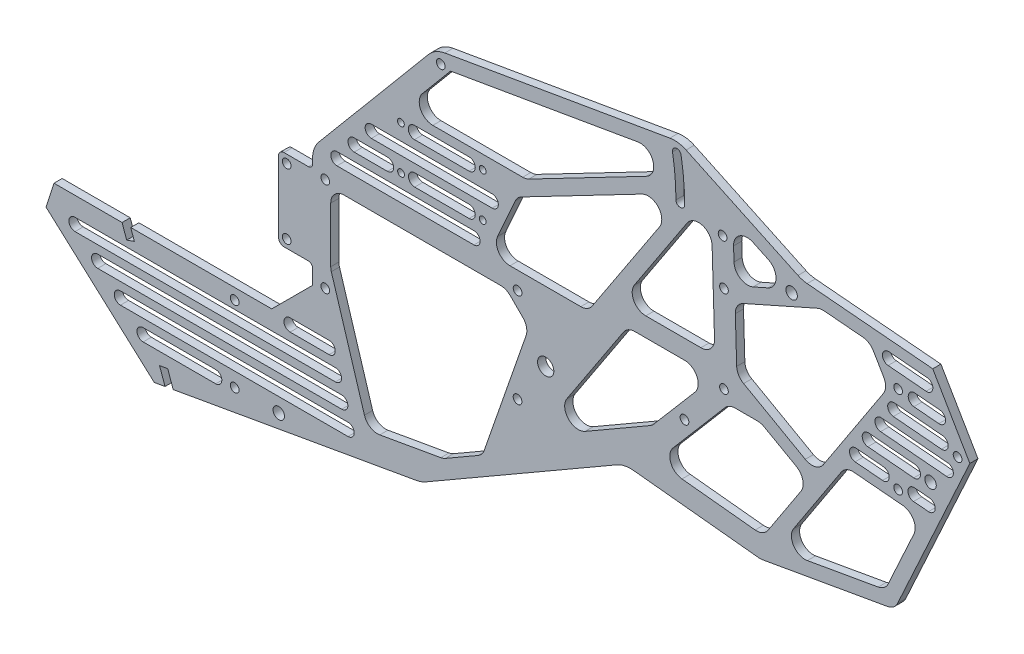
from build123d import *

# Parameters (mm, degrees)
SKETCH1_R           = 1.6
SKETCH1_R_2         = 3
SKETCH1_R_3         = 2.1
BOSS_EXTRUDE1_DEPTH = 3
CUT_EXTRUDE1_DEPTH  = 3
CUT_EXTRUDE2_DEPTH  = 3
SKETCH4_R           = 1.6
SKETCH4_R_2         = 1.25
CUT_EXTRUDE3_DEPTH  = 3
SKETCH5_R           = 1.6
SKETCH5_R_2         = 2.1
CUT_EXTRUDE4_DEPTH  = 3
CUT_EXTRUDE5_DEPTH  = 3
CUT_EXTRUDE6_DEPTH  = 3
FILLET1_R           = 5
FILLET2_R           = 5


with BuildPart() as part:
    # Sketch1 → Boss-Extrude1 (new body)
    with BuildSketch(Plane.XY):
        with BuildLine():
            Line((33.606433282, 69.354528427), (33.606433282, 67.494230769))
            ThreePointArc((33.606433282, 67.494230769), (33.167093454, 66.433570597), (32.106433282, 65.994230769))
            Line((32.106433282, 65.994230769), (23.106433282, 65.994230769))
            ThreePointArc((23.106433282, 65.994230769), (21.692219719, 65.408444332), (21.106433282, 63.994230769))
            Line((21.106433282, 63.994230769), (21.106433282, 37.994230769))
            ThreePointArc((21.106433282, 37.994230769), (21.692219719, 36.580017207), (23.106433282, 35.994230769))
            Line((23.106433282, 35.994230769), (32.106433282, 35.994230769))
            ThreePointArc((32.106433282, 35.994230769), (33.167093454, 35.554890941), (33.606433282, 34.494230769))
            Line((33.606433282, 34.494230769), (33.606433282, 28.994230769))
            Line((33.606433282, 28.994230769), (18.606433282, 13.994230769))
            Line((18.606433282, 13.994230769), (-33.208685877, 13.994230769))
            Line((-33.208685877, 13.994230769), (-31.865678416, 10.226428896))
            Line((-31.865678416, 10.226428896), (-34.691529821, 9.2191733))
            Line((-34.691529821, 9.2191733), (-36.393566718, 13.994230769))
            Line((-36.393566718, 13.994230769), (-61.393566718, 13.994230769))
            Line((-61.393566718, 13.994230769), (-64.338240595, 4.931456458))
            Line((-64.338240595, 4.931456458), (-24.540435349, -31.005769231))
            Line((-24.540435349, -31.005769231), (-20.601204337, -30.31117652))
            Line((-20.601204337, -30.31117652), (-22.615715529, -24.65947371))
            Line((-22.615715529, -24.65947371), (-19.619169292, -24.131101759))
            Line((-19.619169292, -24.131101759), (-17.604658099, -29.782804569))
            Line((-17.604658099, -29.782804569), (71.833626772, -14.012421838))
            ThreePointArc((71.833626772, -14.012421838), (73.517346428, -13.561270516), (75.097144995, -12.824598346))
            Line((75.097144995, -12.824598346), (145.414901265, 27.773377165))
            ThreePointArc((145.414901265, 27.773377165), (148.329156871, 28.893188072), (151.446707108, 29.059749526))
            Line((151.446707108, 29.059749526), (212.432702142, 22.733412992))
            ThreePointArc((212.432702142, 22.733412992), (215.302065541, 21.994439853), (217.828932512, 20.447096669))
            ThreePointArc((217.828932512, 20.447096669), (261.451176936, 21.093233821), (267.109241255, 64.351805341))
            ThreePointArc((267.109241255, 64.351805341), (265.48687235, 69.095784942), (266.370965215, 74.030944831))
            Line((266.370965215, 74.030944831), (275.117398408, 93.06941092))
            Line((275.117398408, 93.06941092), (261.484759484, 116.375014451))
            Line((261.484759484, 116.375014451), (215.3420672, 120.41197693))
            ThreePointArc((215.3420672, 120.41197693), (213.606741864, 120.719693633), (211.952387443, 121.327274937))
            Line((211.952387443, 121.327274937), (170.861805565, 140.682145004))
            ThreePointArc((170.861805565, 140.682145004), (167.944202702, 141.544817238), (164.902224852, 141.490222269))
            Line((164.902224852, 141.490222269), (82.210010789, 127.239213849))
            ThreePointArc((82.210010789, 127.239213849), (78.925127101, 126.054403786), (76.247909886, 123.812363706))
            Line((76.247909886, 123.812363706), (35.945988851, 75.782404523))
            ThreePointArc((35.945988851, 75.782404523), (34.209507074, 72.77472986), (33.606433282, 69.354528427))
        make_face()
        with Locations((5, -17.865711058)):
            Circle(SKETCH1_R, mode=Mode.SUBTRACT)
        with Locations((5, 9.994230769)):
            Circle(SKETCH1_R, mode=Mode.SUBTRACT)
        with Locations((24.106433282, 38.994230769)):
            Circle(SKETCH1_R, mode=Mode.SUBTRACT)
        with Locations((38.27641453, 30.394230769)):
            Circle(SKETCH1_R, mode=Mode.SUBTRACT)
        with Locations((24.106433282, 62.994230769)):
            Circle(SKETCH1_R, mode=Mode.SUBTRACT)
        with Locations((38.27641453, 64.994230769)):
            Circle(SKETCH1_R, mode=Mode.SUBTRACT)
        with Locations((80.724281303, 122.924200116)):
            Circle(SKETCH1_R, mode=Mode.SUBTRACT)
        with Locations((108.936452034, 30.394230769)):
            Circle(SKETCH1_R, mode=Mode.SUBTRACT)
        with Locations((119.266433282, 45.994230769)):
            Circle(SKETCH1_R_2, mode=Mode.SUBTRACT)
        with Locations((108.936452034, 64.994230769)):
            Circle(SKETCH1_R, mode=Mode.SUBTRACT)
        with Locations((21.186685258, -17.865711058)):
            Circle(SKETCH1_R_3, mode=Mode.SUBTRACT)
        with BuildLine():
            Line((-2, -20.135652886), (-28.647304351, -20.135652886))
            ThreePointArc((-28.647304351, -20.135652886), (-30.917246179, -17.865711058), (-28.647304351, -15.595769231))
            Line((-28.647304351, -15.595769231), (-2, -15.595769231))
            ThreePointArc((-2, -15.595769231), (0.269941827, -17.865711058), (-2, -20.135652886))
        make_face(mode=Mode.SUBTRACT)
        with BuildLine():
            Line((46.626657738, -12.605652886), (-36.986219439, -12.605652886))
            ThreePointArc((-36.986219439, -12.605652886), (-39.256161266, -10.335711058), (-36.986219439, -8.065769231))
            Line((-36.986219439, -8.065769231), (46.626657738, -8.065769231))
            ThreePointArc((46.626657738, -8.065769231), (48.896599565, -10.335711058), (46.626657738, -12.605652886))
        make_face(mode=Mode.SUBTRACT)
        with BuildLine():
            Line((44.309159487, -5.075652886), (-45.325134526, -5.075652886))
            ThreePointArc((-45.325134526, -5.075652886), (-47.595076354, -2.805711058), (-45.325134526, -0.535769231))
            Line((-45.325134526, -0.535769231), (44.309159487, -0.535769231))
            ThreePointArc((44.309159487, -0.535769231), (46.579101315, -2.805711058), (44.309159487, -5.075652886))
        make_face(mode=Mode.SUBTRACT)
        with BuildLine():
            Line((41.991661236, 2.454347114), (-53.664049614, 2.454347114))
            ThreePointArc((-53.664049614, 2.454347114), (-55.933991441, 4.724288942), (-53.664049614, 6.994230769))
            Line((-53.664049614, 6.994230769), (41.991661236, 6.994230769))
            ThreePointArc((41.991661236, 6.994230769), (44.261603064, 4.724288942), (41.991661236, 2.454347114))
        make_face(mode=Mode.SUBTRACT)
        with BuildLine():
            Line((39.674162986, 9.984347114), (25.351772829, 9.984347114))
            ThreePointArc((25.351772829, 9.984347114), (23.081831001, 12.254288942), (25.351772829, 14.524230769))
            Line((25.351772829, 14.524230769), (39.674162986, 14.524230769))
            ThreePointArc((39.674162986, 14.524230769), (41.944104813, 12.254288942), (39.674162986, 9.984347114))
        make_face(mode=Mode.SUBTRACT)
        with BuildLine():
            Line((112.062626277, 52.219115126), (96.660010447, 7.956769522))
            ThreePointArc((96.660010447, 7.956769522), (95.790683483, 6.413353898), (94.437758812, 5.269913478))
            Line((94.437758812, 5.269913478), (82.378204185, -1.692673633))
            ThreePointArc((82.378204185, -1.692673633), (81.588304901, -2.061009718), (80.746445073, -2.286585379))
            Line((80.746445073, -2.286585379), (58.320914344, -6.240811503))
            ThreePointArc((58.320914344, -6.240811503), (54.844152372, -5.582404902), (52.673881025, -2.787535434))
            Line((52.673881025, -2.787535434), (40.497622099, 36.775484596))
            ThreePointArc((40.497622099, 36.775484596), (40.332025682, 37.50259487), (40.27641453, 38.246247292))
            Line((40.27641453, 38.246247292), (40.27641453, 58.494230769))
            ThreePointArc((40.27641453, 58.494230769), (41.740880624, 62.029764675), (45.27641453, 63.494230769))
            Line((45.27641453, 63.494230769), (102.708529973, 63.494230769))
            ThreePointArc((102.708529973, 63.494230769), (104.621947134, 63.113628432), (106.244063878, 62.029764675))
            Line((106.244063878, 62.029764675), (110.875908547, 57.397920006))
            ThreePointArc((110.875908547, 57.397920006), (112.214055028, 54.97918487), (112.062626277, 52.219115126))
        make_face(mode=Mode.SUBTRACT)
        with BuildLine():
            ThreePointArc((167.124281303, 122.924200116), (168.724281303, 121.324200116), (170.324281303, 122.924200116))
            ThreePointArc((170.324281303, 122.924200116), (169.998274999, 130.560563753), (169.02262841, 138.141358133))
            ThreePointArc((169.02262841, 138.141358133), (167.174137247, 139.446379366), (165.869116014, 137.597888204))
            ThreePointArc((165.869116014, 137.597888204), (166.809918081, 130.28783648), (167.124281303, 122.924200116))
        make_face(mode=Mode.SUBTRACT)
    extrude(amount=BOSS_EXTRUDE1_DEPTH)

    # Sketch2 → Cut-Extrude1 (cut)
    with BuildSketch(Plane.XY.offset(3)):
        Polygon((151.446707108, 29.059749526), (241.422875717, 19.726139041), (275.117398408, 93.06941092), (318.53181197, -44.262654747), align=None)
    extrude(amount=-CUT_EXTRUDE1_DEPTH, mode=Mode.SUBTRACT)

    # Sketch3 → Cut-Extrude2 (cut)
    with BuildSketch(Plane.XY.offset(3)):
        Polygon((198.229692038, 24.206751611), (247.470079689, 32.889160494), (241.422875717, 19.726139041), align=None)
    extrude(amount=-CUT_EXTRUDE2_DEPTH, mode=Mode.SUBTRACT)

    # Sketch4 → Cut-Extrude3 (cut)
    with BuildSketch(Plane.XY.offset(3)):
        with Locations((184.767611591, 103.568989757)):
            Circle(SKETCH4_R)
        with Locations((184.767611591, 71.568989757)):
            Circle(SKETCH4_R)
        with Locations((248.767611591, 103.568989757)):
            Circle(SKETCH4_R)
        with Locations((248.767611591, 71.568989757)):
            Circle(SKETCH4_R)
        with Locations((66.057748953, 96.994230769)):
            Circle(SKETCH4_R_2)
        with Locations((96.120516229, 96.994230769)):
            Circle(SKETCH4_R_2)
        with Locations((66.120516229, 80.994230769)):
            Circle(SKETCH4_R_2)
        with Locations((96.120516229, 80.994230769)):
            Circle(SKETCH4_R_2)
    extrude(amount=-CUT_EXTRUDE3_DEPTH, mode=Mode.SUBTRACT)

    # Sketch5 → Cut-Extrude4 (cut)
    with BuildSketch(Plane.XY.offset(3)):
        with Locations((184.267611591, 120.119180009)):
            Circle(SKETCH5_R)
        with Locations((170.267611591, 54.568989757)):
            Circle(SKETCH5_R)
        with Locations((270.61335305, 92.847113196)):
            Circle(SKETCH5_R)
        with Locations((209.641360773, 114.61683213)):
            Circle(SKETCH5_R_2)
        with Locations((260.685601414, 79.876300594)):
            Circle(SKETCH5_R_2)
    extrude(amount=-CUT_EXTRUDE4_DEPTH, mode=Mode.SUBTRACT)

    # Sketch6 → Cut-Extrude5 (cut)
    with BuildSketch(Plane.XY.offset(3)):
        with BuildLine():
            Line((134.85979926, 71.494230769), (98.461835392, 71.494230769))
            Line((98.461835392, 71.494230769), (108.765182202, 94.659315822))
            Line((108.765182202, 94.659315822), (154.610313298, 118.522297762))
            ThreePointArc((154.610313298, 118.522297762), (160.630667086, 117.437151644), (161.094872175, 111.337420874))
            Line((161.094872175, 111.337420874), (134.85979926, 71.494230769))
        make_face()
        with BuildLine():
            Line((156.267621783, 125.02173291), (112.027599428, 101.994230769))
            Line((112.027599428, 101.994230769), (67.078173611, 101.994230769))
            Line((67.078173611, 101.994230769), (84.307147675, 122.526922507))
            Line((84.307147675, 122.526922507), (153.109895929, 134.384248566))
            ThreePointArc((153.109895929, 134.384248566), (158.696854523, 131.054814092), (156.267621783, 125.02173291))
        make_face()
        with BuildLine():
            Line((42.565340857, 76.034114424), (92.90473711, 76.034114424))
            ThreePointArc((92.90473711, 76.034114424), (95.174678937, 73.764172597), (92.90473711, 71.494230769))
            Line((92.90473711, 71.494230769), (42.565340857, 71.494230769))
            ThreePointArc((42.565340857, 71.494230769), (40.29539903, 73.764172597), (42.565340857, 76.034114424))
        make_face()
        with BuildLine():
            Line((48.88376108, 83.564114424), (61.120516229, 83.564114424))
            ThreePointArc((61.120516229, 83.564114424), (63.390458057, 81.294172597), (61.120516229, 79.024230769))
            Line((61.120516229, 79.024230769), (48.88376108, 79.024230769))
            ThreePointArc((48.88376108, 79.024230769), (46.613819253, 81.294172597), (48.88376108, 83.564114424))
        make_face()
        with BuildLine():
            Line((71.120516229, 83.564114424), (91.120516229, 83.564114424))
            ThreePointArc((91.120516229, 83.564114424), (93.390458057, 81.294172597), (91.120516229, 79.024230769))
            Line((91.120516229, 79.024230769), (71.120516229, 79.024230769))
            ThreePointArc((71.120516229, 79.024230769), (68.850574402, 81.294172597), (71.120516229, 83.564114424))
        make_face()
        with BuildLine():
            Line((55.202181303, 91.094114424), (99.60311109, 91.094114424))
            ThreePointArc((99.60311109, 91.094114424), (101.873052917, 88.824172597), (99.60311109, 86.554230769))
            Line((99.60311109, 86.554230769), (55.202181303, 86.554230769))
            ThreePointArc((55.202181303, 86.554230769), (52.932239475, 88.824172597), (55.202181303, 91.094114424))
        make_face()
        with BuildLine():
            Line((71.057748953, 98.624114424), (91.120516229, 98.624114424))
            ThreePointArc((91.120516229, 98.624114424), (93.390458057, 96.354172597), (91.120516229, 94.084230769))
            Line((91.120516229, 94.084230769), (71.057748953, 94.084230769))
            ThreePointArc((71.057748953, 94.084230769), (68.787807125, 96.354172597), (71.057748953, 98.624114424))
        make_face()
    extrude(amount=-CUT_EXTRUDE5_DEPTH, mode=Mode.SUBTRACT)

    # Sketch7 → Cut-Extrude6 (cut)
    with BuildSketch(Plane.XY.offset(3)):
        Polygon((146.77250571, 80.494230769), (179.941073241, 130.867315149), (181.462901197, 80.494230769), align=None)
        with BuildLine():
            Line((188.059915073, 127.054422287), (201.041902395, 120.939525239))
            ThreePointArc((201.041902395, 120.939525239), (203.910975235, 116.360652801), (200.9408781, 111.846655152))
            Line((200.9408781, 111.846655152), (188.683829871, 106.402605049))
            Line((188.683829871, 106.402605049), (188.059915073, 127.054422287))
        make_face()
        Polygon((149.347198528, 73.494230769), (181.152339991, 73.494230769), (158.3970747, 46.815643876), (115.455910476, 22.023551152), align=None)
        Polygon((186.61323582, 67.568989757), (159.881003691, 36.227752088), (199.273093613, 32.141443133), (215.978603898, 57.655410206), (198.405633052, 67.568989757), align=None)
        Polygon((188.846926577, 101.004042037), (189.532373469, 78.315489077), (218.72351724, 61.8476574), (245.033539221, 102.03038891), (238.397009778, 113.375831629), (220.271747085, 114.961586638), align=None)
        Polygon((229.537613584, 69.236117232), (204.050540061, 30.310257227), (244.02074034, 37.358081961), (257.540269046, 66.78620233), align=None)
        with BuildLine():
            Line((245.485793121, 113.759463286), (259.457759132, 112.537074652))
            ThreePointArc((259.457759132, 112.537074652), (261.52122468, 110.077932173), (259.0620822, 108.014466626))
            Line((259.0620822, 108.014466626), (245.090116189, 109.236855259))
            ThreePointArc((245.090116189, 109.236855259), (243.026650642, 111.695997738), (245.485793121, 113.759463286))
        make_face()
        with BuildLine():
            Line((254.9479879, 105.372865134), (264.117748628, 104.570615023))
            ThreePointArc((264.117748628, 104.570615023), (266.181214175, 102.111472543), (263.722071696, 100.048006996))
            Line((263.722071696, 100.048006996), (254.552310968, 100.850257107))
            ThreePointArc((254.552310968, 100.850257107), (252.488845421, 103.309399586), (254.9479879, 105.372865134))
        make_face()
        with BuildLine():
            Line((247.398983869, 98.474554031), (265.0932758, 96.926504077))
            ThreePointArc((265.0932758, 96.926504077), (267.156741347, 94.467361598), (264.697598868, 92.403896051))
            Line((264.697598868, 92.403896051), (247.003306937, 93.951946004))
            ThreePointArc((247.003306937, 93.951946004), (244.939841389, 96.411088483), (247.398983869, 98.474554031))
        make_face()
        with BuildLine():
            Line((242.717960226, 91.325327156), (266.996884147, 89.201196551))
            ThreePointArc((266.996884147, 89.201196551), (269.060349694, 86.742054071), (266.601207215, 84.678588524))
            Line((266.601207215, 84.678588524), (242.322283294, 86.802719129))
            ThreePointArc((242.322283294, 86.802719129), (240.258817747, 89.261861609), (242.717960226, 91.325327156))
        make_face()
        with BuildLine():
            Line((238.036936584, 84.176100282), (254.909847116, 82.69991189))
            ThreePointArc((254.909847116, 82.69991189), (256.973312663, 80.24076941), (254.514170184, 78.177303863))
            Line((254.514170184, 78.177303863), (237.641259652, 79.653492255))
            ThreePointArc((237.641259652, 79.653492255), (235.577794105, 82.112634735), (238.036936584, 84.176100282))
        make_face()
        with BuildLine():
            Line((233.355912942, 77.026873408), (243.430122897, 76.145494243))
            ThreePointArc((243.430122897, 76.145494243), (245.493588444, 73.686351763), (243.034445965, 71.622886216))
            Line((243.034445965, 71.622886216), (232.96023601, 72.504265381))
            ThreePointArc((232.96023601, 72.504265381), (230.896770462, 74.96340786), (233.355912942, 77.026873408))
        make_face()
        with BuildLine():
            Line((254.818713503, 75.149121671), (260.320123117, 74.667810696))
            ThreePointArc((260.320123117, 74.667810696), (262.383588665, 72.208668217), (259.924446185, 70.14520267))
            Line((259.924446185, 70.14520267), (254.423036571, 70.626513644))
            ThreePointArc((254.423036571, 70.626513644), (252.359571024, 73.085656124), (254.818713503, 75.149121671))
        make_face()
    extrude(amount=-CUT_EXTRUDE6_DEPTH, mode=Mode.SUBTRACT)

    # Fillet1
    fillet1_edges = [part.edges().sort_by_distance(p)[0] for p in [
        (134.85979926, 71.494230769, 1.5),
        (98.461835392, 71.494230769, 1.5),
        (108.765182202, 94.659315822, 1.5),
        (112.027599428, 101.994230769, 1.5),
        (67.078173611, 101.994230769, 1.5),
        (229.537613584, 69.236117232, 1.5),
        (257.540269046, 66.78620233, 1.5),
        (244.02074034, 37.358081961, 1.5),
        (204.050540061, 30.310257227, 1.5),
        (188.683829871, 106.402605049, 1.5),
        (188.059915073, 127.054422287, 1.5),
        (158.3970747, 46.815643876, 1.5),
        (115.455910476, 22.023551152, 1.5),
        (149.347198528, 73.494230769, 1.5),
        (181.152339991, 73.494230769, 1.5),
        (188.846926577, 101.004042037, 1.5),
        (220.271747085, 114.961586638, 1.5),
        (238.397009778, 113.375831629, 1.5),
        (245.033539221, 102.03038891, 1.5),
        (218.72351724, 61.8476574, 1.5),
        (189.532373469, 78.315489077, 1.5),
        (186.61323582, 67.568989757, 1.5),
        (198.405633052, 67.568989757, 1.5),
        (215.978603898, 57.655410206, 1.5),
        (199.273093613, 32.141443133, 1.5),
        (159.881003691, 36.227752088, 1.5),
        (181.462901197, 80.494230769, 1.5),
        (146.77250571, 80.494230769, 1.5),
        (179.941073241, 130.867315149, 1.5),
    ]]
    fillet(fillet1_edges, radius=FILLET1_R)

    # Fillet2
    fillet2_edges = [part.edges().sort_by_distance(p)[0] for p in [
        (198.229692038, 24.206751611, 1.5),
        (247.470079689, 32.889160494, 1.5),
    ]]
    fillet(fillet2_edges, radius=FILLET2_R)


solid = part.part
